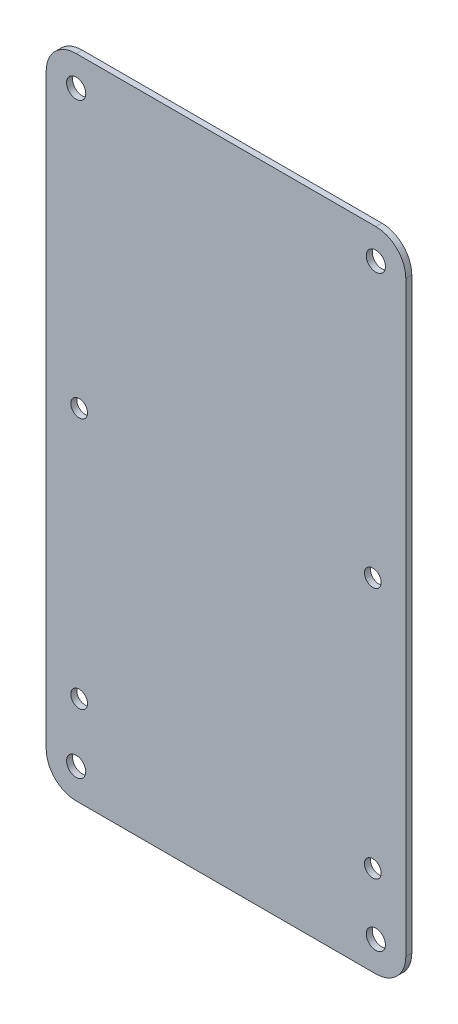
from build123d import *

# Parameters (mm, degrees)
SKETCH_1_W          = 60
SKETCH_1_H          = 108
EXTRUDE_1_DEPTH     = 1
SKETCH_4_R          = 1.4
CUT_EXTRUDE_2_DEPTH = 10
SKETCH_9_R          = 1.6
CUT_EXTRUDE_5_DEPTH = 62.781874365
FILLET_1_R          = 5


with BuildPart() as part:
    # ｽｹｯﾁ1 → ﾎﾞｽ - 押し出し1 (new body)
    with BuildSketch(Plane.XY):
        Rectangle(SKETCH_1_W, SKETCH_1_H)
    extrude(amount=EXTRUDE_1_DEPTH)

    # ｽｹｯﾁ4 → ｶｯﾄ - 押し出し2 (cut)
    with BuildSketch(Plane.XY.offset(1)):
        with Locations((-24.5, 3)):
            Circle(SKETCH_4_R)
        with Locations((-24.5, -39)):
            Circle(SKETCH_4_R)
        with Locations((24.5, 3)):
            Circle(SKETCH_4_R)
        with Locations((24.5, -39)):
            Circle(SKETCH_4_R)
    extrude(amount=-CUT_EXTRUDE_2_DEPTH, mode=Mode.SUBTRACT)

    # ｽｹｯﾁ9 → ｶｯﾄ - 押し出し5 (cut, through all)
    with BuildSketch(Plane.XY.offset(1)):
        with Locations((25, 49)):
            Circle(SKETCH_9_R)
        with Locations((-25, 49)):
            Circle(SKETCH_9_R)
        with Locations((-25, -49)):
            Circle(SKETCH_9_R)
        with Locations((25, -49)):
            Circle(SKETCH_9_R)
    extrude(amount=-CUT_EXTRUDE_5_DEPTH, mode=Mode.SUBTRACT)

    # ﾌｨﾚｯﾄ1
    fillet_1_edges = [part.edges().sort_by_distance(p)[0] for p in [
        (30, -54, 0.5),
        (-30, -54, 0.5),
        (-30, 54, 0.5),
        (30, 54, 0.5),
    ]]
    fillet(fillet_1_edges, radius=FILLET_1_R)


solid = part.part
